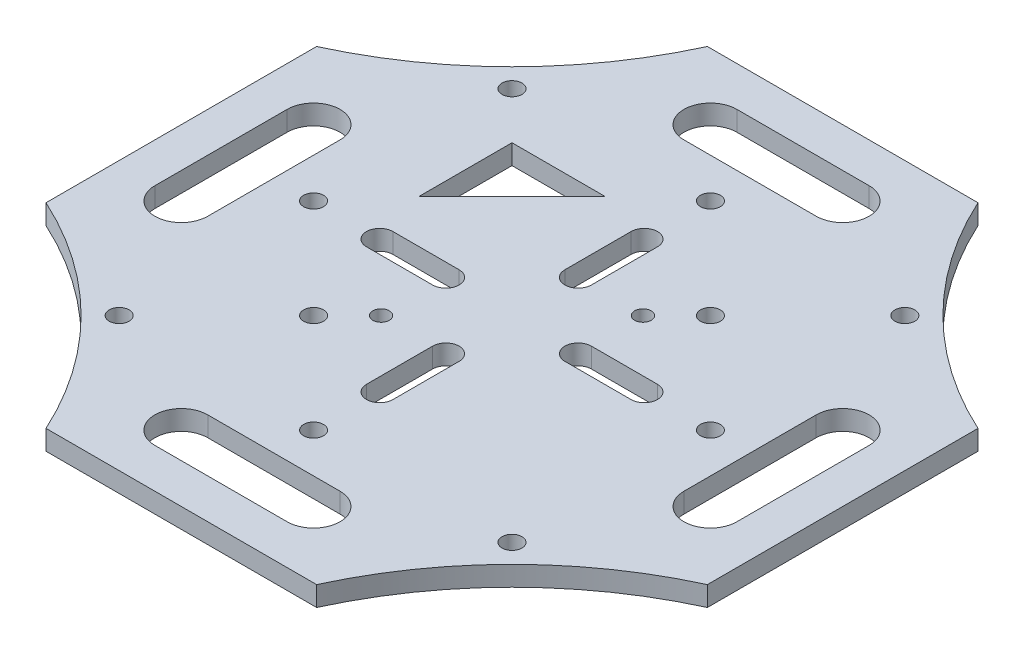
from build123d import *

# Parameters (mm, degrees)
SKETCH_1_R               = 1.25
EXTRUDE_1_DEPTH          = 3
SKETCH_2_R               = 1.5
CUT_EXTRUDE_1_DEPTH      = 3
CUT_EXTRUDE_2_DEPTH      = 3
CUT_EXTRUDE_3_DEPTH      = 3
CUT_EXTRUDE_4_DEPTH      = 10
SKETCH_6_R               = 1.5
CUT_EXTRUDE_5_DEPTH      = 10
SKETCH_7_R               = 1.5
CUT_EXTRUDE_8_DEPTH      = 10
SKETCH_8_R               = 1.5
CUT_EXTRUDE_9_DEPTH      = 10
SKETCH_9_R               = 15
CUT_EXTRUDE_10_DEPTH     = 10
SKETCH_11_R              = 1.5
EXTRUDE_3_DEPTH          = 3
CUT_EXTRUDE_12_DEPTH     = 3
EXTRUDE_4_DEPTH          = 3
SKETCH_15_R              = 15
EXTRUDE_5_DEPTH          = 3
CUT_EXTRUDE_13_DEPTH     = 3
EXTRUDE_START            = -3
EXTRUDE_7_DEPTH          = 3
CUT_EXTRUDE_14_DEPTH     = 3
CUT_EXTRUDE_15_DEPTH     = 3
PATTERN_CIRCULAR_1_COUNT = 8
SKETCH_22_R              = 1.25
CUT_EXTRUDE_17_DEPTH     = 3
SKETCH_23_R              = 1.5
CUT_EXTRUDE_18_DEPTH     = 10
SKETCH_24_R              = 1.5
CUT_EXTRUDE_19_DEPTH     = 10
CUT_EXTRUDE_START        = -48
CUT_EXTRUDE_21_DEPTH     = 48
SKETCH_26_W              = 47.062790234
SKETCH_26_H              = 40.912878854
SKETCH_26_W_2            = 40.912878854
SKETCH_26_H_2            = 47.062790234
CUT_EXTRUDE_22_DEPTH     = 48


with BuildPart() as part:
    # 草图1 → 凸台-拉伸1 (new body)
    # profile 1 of 4: a face of its own
    with BuildSketch(Plane(origin=(0, 0, 0), x_dir=(1, 0, 0), z_dir=(0, 1, 0))):
        with BuildLine():
            ThreePointArc((75, -15), (32.573593129, -32.573593129), (15, -75))
            Line((15, -75), (0, -75))
            Line((0, -75), (0, 0))
            Line((0, 0), (75, 0))
            Line((75, 0), (75, -15))
        make_face()
        with Locations(Location((11, -70, 0), (0, 0, 270))):
            Circle(SKETCH_1_R, mode=Mode.SUBTRACT)
        with Locations(Location((70, -11, 0), (0, 0, 270))):
            Circle(SKETCH_1_R, mode=Mode.SUBTRACT)
    # profile 2 of 4: a face of its own
    with BuildSketch(Plane(origin=(0, 0, 0), x_dir=(1, 0, 0), z_dir=(0, 1, 0))):
        with BuildLine():
            ThreePointArc((-15, -75), (-32.573593129, -32.573593129), (-75, -15))
            Line((-75, -15), (-75, 0))
            Line((-75, 0), (0, 0))
            Line((0, 0), (0, -75))
            Line((0, -75), (-15, -75))
        make_face()
        with Locations(Location((-70, -11, 0), (0, 0, 270))):
            Circle(SKETCH_1_R, mode=Mode.SUBTRACT)
        with Locations(Location((-11, -70, 0), (0, 0, 270))):
            Circle(SKETCH_1_R, mode=Mode.SUBTRACT)
    # profile 3 of 4: a face of its own
    with BuildSketch(Plane(origin=(0, 0, 0), x_dir=(1, 0, 0), z_dir=(0, 1, 0))):
        with BuildLine():
            ThreePointArc((-75, 15), (-32.573593129, 32.573593129), (-15, 75))
            Line((-15, 75), (0, 75))
            Line((0, 75), (0, 0))
            Line((0, 0), (-75, 0))
            Line((-75, 0), (-75, 15))
        make_face()
        with Locations(Location((-11, 70, 0), (0, 0, 270))):
            Circle(SKETCH_1_R, mode=Mode.SUBTRACT)
        with Locations(Location((-70, 11, 0), (0, 0, 270))):
            Circle(SKETCH_1_R, mode=Mode.SUBTRACT)
    # profile 4 of 4: a face of its own
    with BuildSketch(Plane(origin=(0, 0, 0), x_dir=(1, 0, 0), z_dir=(0, 1, 0))):
        with BuildLine():
            ThreePointArc((15, 75), (32.573593129, 32.573593129), (75, 15))
            Line((75, 15), (75, 0))
            Line((75, 0), (0, 0))
            Line((0, 0), (0, 75))
            Line((0, 75), (15, 75))
        make_face()
        with Locations(Location((70, 11, 0), (0, 0, 270))):
            Circle(SKETCH_1_R, mode=Mode.SUBTRACT)
        with Locations(Location((11, 70, 0), (0, 0, 270))):
            Circle(SKETCH_1_R, mode=Mode.SUBTRACT)
    extrude(amount=EXTRUDE_1_DEPTH)

    # 草图2 → 切除-拉伸1 (cut)
    with BuildSketch(Plane.XZ):
        with Locations(Location((0.353553391, -31.466251763, 0), (0, 0, 270))):
            Circle(SKETCH_2_R)
        with Locations(Location((31.466251763, -0.353553391, 0), (0, 0, 270))):
            Circle(SKETCH_2_R)
        with Locations(Location((-0.353553391, 31.466251763, 0), (0, 0, 90))):
            Circle(SKETCH_2_R)
        with Locations(Location((-31.466251763, 0.353553391, 0), (0, 0, 90))):
            Circle(SKETCH_2_R)
    extrude(amount=-CUT_EXTRUDE_1_DEPTH, mode=Mode.SUBTRACT)

    # 草图3 → 切除-拉伸2 (cut)
    with BuildSketch(Plane(origin=(0, 3, 0), x_dir=(1, 0, 0), z_dir=(0, 1, 0))):
        Polygon((-15.556349186, 15.556349186), (-12.02081528, 19.091883092), (-22.627416998, 22.627416998), align=None)
        Polygon((-19.091883092, 12.02081528), (-15.556349186, 15.556349186), (-22.627416998, 22.627416998), align=None)
    extrude(amount=-CUT_EXTRUDE_2_DEPTH, mode=Mode.SUBTRACT)

    # 草图4 → 切除-拉伸3 (cut)
    with BuildSketch(Plane(origin=(0, 3, 0), x_dir=(1, 0, 0), z_dir=(0, 1, 0))):
        with BuildLine():
            ThreePointArc((33.944668714, -19.80253309), (34.043922781, -8.582763971), (22.827665534, -8.285032838))
            Line((22.827665534, -8.285032838), (15.556349186, -15.556349186))
            Line((15.556349186, -15.556349186), (8.285032838, -22.827665534))
            ThreePointArc((8.285032838, -22.827665534), (8.582763971, -34.043922781), (19.80253309, -33.944668714))
            Line((19.80253309, -33.944668714), (33.944668714, -19.80253309))
        make_face()
    extrude(amount=-CUT_EXTRUDE_3_DEPTH, mode=Mode.SUBTRACT)

    # 草图5 → 切除-拉伸4 (cut)
    with BuildSketch(Plane(origin=(0, 3, 0), x_dir=(1, 0, 0), z_dir=(0, 1, 0))):
        Polygon((-22.627416998, 8.485281374), (-22.627416998, 22.627416998), (-19.091883092, 12.02081528), align=None)
        Polygon((-12.02081528, 19.091883092), (-22.627416998, 22.627416998), (-8.485281374, 22.627416998), align=None)
    extrude(amount=-CUT_EXTRUDE_4_DEPTH, mode=Mode.SUBTRACT)

    # 草图6 → 切除-拉伸5 (cut)
    with BuildSketch(Plane(origin=(0, 3, 0), x_dir=(1, 0, 0), z_dir=(0, 1, 0))):
        with Locations(Location((-35.355339059, -21.213203436, 0), (0, 0, 270))):
            Circle(SKETCH_6_R)
        with Locations(Location((-21.213203436, -35.355339059, 0), (0, 0, 270))):
            Circle(SKETCH_6_R)
        with Locations(Location((35.355339059, 21.213203436, 0), (0, 0, 270))):
            Circle(SKETCH_6_R)
        with Locations(Location((21.213203436, 35.355339059, 0), (0, 0, 270))):
            Circle(SKETCH_6_R)
    extrude(amount=-CUT_EXTRUDE_5_DEPTH, mode=Mode.SUBTRACT)

    # 草图7 → 切除-拉伸8 (cut)
    with BuildSketch(Plane(origin=(0, 3, 0), x_dir=(1, 0, 0), z_dir=(0, 1, 0))):
        with Locations(Location((-29.69848481, 29.69848481, 0), (0, 0, 270))):
            Circle(SKETCH_7_R)
        with Locations(Location((29.69848481, 29.69848481, 0), (0, 0, 270))):
            Circle(SKETCH_7_R)
        with Locations(Location((29.69848481, -29.69848481, 0), (0, 0, 270))):
            Circle(SKETCH_7_R)
        with Locations(Location((-29.69848481, -29.69848481, 0), (0, 0, 270))):
            Circle(SKETCH_7_R)
    extrude(amount=-CUT_EXTRUDE_8_DEPTH, mode=Mode.SUBTRACT)

    # 草图8 → 切除-拉伸9 (cut)
    with BuildSketch(Plane(origin=(0, 3, 0), x_dir=(1, 0, 0), z_dir=(0, 1, 0))):
        with Locations(Location((-11, 55, 0), (0, 0, 270))):
            Circle(SKETCH_8_R)
        with Locations(Location((11, 55, 0), (0, 0, 270))):
            Circle(SKETCH_8_R)
        with Locations(Location((55, 11, 0), (0, 0, 270))):
            Circle(SKETCH_8_R)
        with Locations(Location((55, -11, 0), (0, 0, 270))):
            Circle(SKETCH_8_R)
        with Locations(Location((11, -55, 0), (0, 0, 270))):
            Circle(SKETCH_8_R)
        with Locations(Location((-11, -55, 0), (0, 0, 270))):
            Circle(SKETCH_8_R)
        with Locations(Location((-55, -11, 0), (0, 0, 270))):
            Circle(SKETCH_8_R)
        with Locations(Location((-55, 11, 0), (0, 0, 270))):
            Circle(SKETCH_8_R)
    extrude(amount=-CUT_EXTRUDE_9_DEPTH, mode=Mode.SUBTRACT)

    # 草图9 → 切除-拉伸10 (cut)
    with BuildSketch(Plane(origin=(0, 3, 0), x_dir=(1, 0, 0), z_dir=(0, 1, 0))):
        with Locations(Location((0, 0, 0), (0, 0, 270))):
            Circle(SKETCH_9_R)
    extrude(amount=-CUT_EXTRUDE_10_DEPTH, mode=Mode.SUBTRACT)

    # 草图11 → 凸台-拉伸3 (add)
    with BuildSketch(Plane(origin=(0, 3, 0), x_dir=(1, 0, 0), z_dir=(0, 1, 0))):
        with Locations((-35.355339059, -21.213203436)):
            Circle(SKETCH_11_R)
        with Locations((35.355339059, 21.213203436)):
            Circle(SKETCH_11_R)
        with Locations((21.213203436, 35.355339059)):
            Circle(SKETCH_11_R)
        with Locations((0.353553391, 31.466251763)):
            Circle(SKETCH_11_R)
        with Locations((31.466251763, 0.353553391)):
            Circle(SKETCH_11_R)
        with Locations((-0.353553391, -31.466251763)):
            Circle(SKETCH_11_R)
        with Locations((-31.466251763, -0.353553391)):
            Circle(SKETCH_11_R)
        with Locations((-21.213203436, -35.355339059)):
            Circle(SKETCH_11_R)
    extrude(amount=-EXTRUDE_3_DEPTH)

    # 草图12 → 切除-拉伸12 (cut)
    with BuildSketch(Plane(origin=(0, 3, 0), x_dir=(1, 0, 0), z_dir=(0, 1, 0))):
        with BuildLine():
            Line((-44, -10), (-44, 10))
            ThreePointArc((-44, 10), (-40, 14), (-36, 10))
            Line((-36, 10), (-36, -10))
            ThreePointArc((-36, -10), (-40, -14), (-44, -10))
        make_face()
        with BuildLine():
            Line((-10, 44), (10, 44))
            ThreePointArc((10, 44), (14, 40), (10, 36))
            Line((10, 36), (-10, 36))
            ThreePointArc((-10, 36), (-14, 40), (-10, 44))
        make_face()
        with BuildLine():
            Line((44, 10), (44, -10))
            ThreePointArc((44, -10), (40, -14), (36, -10))
            Line((36, -10), (36, 10))
            ThreePointArc((36, 10), (40, 14), (44, 10))
        make_face()
        with BuildLine():
            Line((10, -44), (-10, -44))
            ThreePointArc((-10, -44), (-14, -40), (-10, -36))
            Line((-10, -36), (10, -36))
            ThreePointArc((10, -36), (14, -40), (10, -44))
        make_face()
    extrude(amount=-CUT_EXTRUDE_12_DEPTH, mode=Mode.SUBTRACT)

    # 草图14 → 凸台-拉伸4 (add)
    with BuildSketch(Plane(origin=(0, 3, 0), x_dir=(1, 0, 0), z_dir=(0, 1, 0))):
        with BuildLine():
            ThreePointArc((32.185650849, -7.152183109), (27.322232167, -6.195143755), (22.827665534, -8.285032838))
            Line((22.827665534, -8.285032838), (21.61516096, -18.569682002))
            ThreePointArc((21.61516096, -18.569682002), (27.487806659, -22.107425519), (33.944668714, -19.80253309))
            ThreePointArc((33.944668714, -19.80253309), (35.679936943, -17.205520658), (36.289282113, -14.142135624))
            ThreePointArc((36.289282113, -14.142135624), (35.187559777, -10.089382679), (32.185650849, -7.152183109))
        make_face()
        with BuildLine():
            Line((22.827665534, -8.285032838), (22.427168462, -8.685529911))
            ThreePointArc((22.427168462, -8.685529911), (20.306137435, -13.486712231), (21.61516096, -18.569682002))
            Line((21.61516096, -18.569682002), (22.827665534, -8.285032838))
        make_face()
        with BuildLine():
            Line((22.427168462, -8.685529911), (8.285032838, -22.827665534))
            ThreePointArc((8.285032838, -22.827665534), (8.582763971, -34.043922781), (19.80253309, -33.944668714))
            Line((19.80253309, -33.944668714), (21.61516096, -18.569682002))
            ThreePointArc((21.61516096, -18.569682002), (20.306137435, -13.486712231), (22.427168462, -8.685529911))
        make_face()
        with BuildLine():
            Line((21.61516096, -18.569682002), (19.80253309, -33.944668714))
            Line((19.80253309, -33.944668714), (33.944668714, -19.80253309))
            ThreePointArc((33.944668714, -19.80253309), (27.487806659, -22.107425519), (21.61516096, -18.569682002))
        make_face()
    extrude(amount=-EXTRUDE_4_DEPTH)

    # 草图15 → 凸台-拉伸5 (add)
    with BuildSketch(Plane(origin=(0, 3, 0), x_dir=(1, 0, 0), z_dir=(0, 1, 0))):
        Circle(SKETCH_15_R)
    extrude(amount=-EXTRUDE_5_DEPTH)

    # 草图17 → 切除-拉伸13 (cut)
    with BuildSketch(Plane(origin=(0, 3, 0), x_dir=(1, 0, 0), z_dir=(0, 1, 0))):
        with BuildLine():
            Line((-2, -20), (-2, -10))
            ThreePointArc((-2, -10), (0, -8), (2, -10))
            Line((2, -10), (2, -20))
            ThreePointArc((2, -20), (0, -22), (-2, -20))
        make_face()
        with BuildLine():
            Line((-20, 2), (-10, 2))
            ThreePointArc((-10, 2), (-8, 0), (-10, -2))
            Line((-10, -2), (-20, -2))
            ThreePointArc((-20, -2), (-22, 0), (-20, 2))
        make_face()
        with BuildLine():
            Line((2, 20), (2, 10))
            ThreePointArc((2, 10), (0, 8), (-2, 10))
            Line((-2, 10), (-2, 20))
            ThreePointArc((-2, 20), (0, 22), (2, 20))
        make_face()
        with BuildLine():
            Line((20, -2), (10, -2))
            ThreePointArc((10, -2), (8, 0), (10, 2))
            Line((10, 2), (20, 2))
            ThreePointArc((20, 2), (22, 0), (20, -2))
        make_face()
    extrude(amount=-CUT_EXTRUDE_13_DEPTH, mode=Mode.SUBTRACT)

    # 草图18 → 凸台-拉伸7 (add)
    with BuildSketch(Plane(origin=(0, 3, 0), x_dir=(1, 0, 0), z_dir=(0, 1, 0)).offset(EXTRUDE_START)):
        with BuildLine():
            Line((-61.977302058, 38.525223259), (-50.251262658, 50.251262658))
            Line((-50.251262658, 50.251262658), (-38.525223259, 61.977302058))
            ThreePointArc((-38.525223259, 61.977302058), (-38.078377186, 64.938218885), (-37.928932188, 67.928932188))
            ThreePointArc((-37.928932188, 67.928932188), (-91.15121571, 86.921708395), (-61.977302058, 38.525223259))
        make_face()
        with BuildLine():
            ThreePointArc((-61.977302058, 38.525223259), (-53.742560533, 41.49511182), (-46.715728753, 46.715728753))
            Line((-46.715728753, 46.715728753), (-50.251262658, 50.251262658))
            Line((-50.251262658, 50.251262658), (-61.977302058, 38.525223259))
        make_face()
        with BuildLine():
            Line((-50.251262658, 50.251262658), (-46.715728753, 46.715728753))
            ThreePointArc((-46.715728753, 46.715728753), (-41.49511182, 53.742560534), (-38.525223259, 61.977302058))
            Line((-38.525223259, 61.977302058), (-50.251262658, 50.251262658))
        make_face()
        with BuildLine():
            ThreePointArc((-45.952273324, 22.500194525), (-38.909748111, 27.067821679), (-32.573593129, 32.573593129))
            Line((-32.573593129, 32.573593129), (-46.715728753, 46.715728753))
            ThreePointArc((-46.715728753, 46.715728753), (-53.742560533, 41.49511182), (-61.977302058, 38.525223259))
            Line((-61.977302058, 38.525223259), (-45.952273324, 22.500194525))
        make_face()
        with BuildLine():
            Line((-46.715728753, 46.715728753), (-32.573593129, 32.573593129))
            ThreePointArc((-32.573593129, 32.573593129), (-27.067821679, 38.909748111), (-22.500194525, 45.952273324))
            Line((-22.500194525, 45.952273324), (-38.525223259, 61.977302058))
            ThreePointArc((-38.525223259, 61.977302058), (-41.49511182, 53.742560534), (-46.715728753, 46.715728753))
        make_face()
    extrude(amount=EXTRUDE_7_DEPTH)

    # 草图19 → 切除-拉伸14 (cut)
    with BuildSketch(Plane(origin=(0, 3, 0), x_dir=(1, 0, 0), z_dir=(0, 1, 0))):
        with BuildLine():
            ThreePointArc((-37.140781925, 51.282917549), (-39.866501787, 47.012431525), (-43.180194847, 43.180194847))
            Line((-43.180194847, 43.180194847), (-36.109127035, 36.109127035))
            ThreePointArc((-36.109127035, 36.109127035), (-32.750813989, 39.866501787), (-29.833680261, 43.975815885))
            Line((-29.833680261, 43.975815885), (-37.140781925, 51.282917549))
        make_face()
        with BuildLine():
            Line((-36.109127035, 36.109127035), (-43.180194847, 43.180194847))
            ThreePointArc((-43.180194847, 43.180194847), (-47.012431525, 39.866501787), (-51.282917549, 37.140781925))
            Line((-51.282917549, 37.140781925), (-43.975815885, 29.833680261))
            ThreePointArc((-43.975815885, 29.833680261), (-39.866501787, 32.750813989), (-36.109127035, 36.109127035))
        make_face()
    extrude(amount=-CUT_EXTRUDE_14_DEPTH, mode=Mode.SUBTRACT)

    # 草图21 → 切除-拉伸15 (cut)
    with BuildSketch(Plane(origin=(0, 3, 0), x_dir=(1, 0, 0), z_dir=(0, 1, 0))):
        with BuildLine():
            Line((-81.187184335, 82.954951288), (-74.116116524, 75.883883476))
            ThreePointArc((-74.116116524, 75.883883476), (-74.116116524, 74.116116524), (-75.883883476, 74.116116524))
            Line((-75.883883476, 74.116116524), (-82.954951288, 81.187184335))
            ThreePointArc((-82.954951288, 81.187184335), (-82.954951288, 82.954951288), (-81.187184335, 82.954951288))
        make_face()
        with BuildLine():
            Line((-59.9739809, 61.741747853), (-52.902913088, 54.670680041))
            ThreePointArc((-52.902913088, 54.670680041), (-52.902913088, 52.902913088), (-54.670680041, 52.902913088))
            Line((-54.670680041, 52.902913088), (-61.741747853, 59.9739809))
            ThreePointArc((-61.741747853, 59.9739809), (-61.741747853, 61.741747853), (-59.9739809, 61.741747853))
        make_face()
    cut_extrude_15 = extrude(amount=-CUT_EXTRUDE_15_DEPTH, mode=Mode.SUBTRACT)

    # 阵列(圆周)1: 切除-拉伸15 ×8 about axis
    pattern_circular_1_axis = Axis((-67.928932188, 0, -67.928932188), (0, 1, 0))
    for i in range(1, PATTERN_CIRCULAR_1_COUNT):
        add(cut_extrude_15.rotate(pattern_circular_1_axis, i * 360 / PATTERN_CIRCULAR_1_COUNT), mode=Mode.SUBTRACT)

    # 草图22 → 切除-拉伸17 (cut)
    with BuildSketch(Plane(origin=(0, 3, 0), x_dir=(1, 0, 0), z_dir=(0, 1, 0))):
        with Locations(Location((9.899494937, 9.899494937, 0), (0, 0, 270))):
            Circle(SKETCH_22_R)
        with Locations(Location((-9.899494937, -9.899494937, 0), (0, 0, 270))):
            Circle(SKETCH_22_R)
    extrude(amount=-CUT_EXTRUDE_17_DEPTH, mode=Mode.SUBTRACT)

    # 草图23 → 切除-拉伸18 (cut)
    with BuildSketch(Plane(origin=(0, 3, 0), x_dir=(1, 0, 0), z_dir=(0, 1, 0))):
        with Locations(Location((0, 30, 0), (0, 0, 270))):
            Circle(SKETCH_23_R)
        with Locations(Location((30, 0, 0), (0, 0, 270))):
            Circle(SKETCH_23_R)
        with Locations(Location((0, -30, 0), (0, 0, 270))):
            Circle(SKETCH_23_R)
        with Locations(Location((-30, 0, 0), (0, 0, 270))):
            Circle(SKETCH_23_R)
    extrude(amount=-CUT_EXTRUDE_18_DEPTH, mode=Mode.SUBTRACT)

    # 草图24 → 切除-拉伸19 (cut)
    with BuildSketch(Plane(origin=(0, 3, 0), x_dir=(1, 0, 0), z_dir=(0, 1, 0))):
        with Locations(Location((-15, -15, 0), (0, 0, 270))):
            Circle(SKETCH_24_R)
        with Locations(Location((15, 15, 0), (0, 0, 270))):
            Circle(SKETCH_24_R)
    extrude(amount=-CUT_EXTRUDE_19_DEPTH, mode=Mode.SUBTRACT)

    # 草图25 → 切除-拉伸21 (cut)
    with BuildSketch(Plane(origin=(0, 3, 0), x_dir=(1, 0, 0), z_dir=(0, 1, 0)).offset(CUT_EXTRUDE_START)):
        with BuildLine():
            ThreePointArc((-22.500194525, 45.952273324), (-16.905300033, 59.999805477), (-15, 75))
            ThreePointArc((-15, 75), (-133.094699967, 90.000194523), (-22.500194525, 45.952273324))
        make_face()
    extrude(amount=CUT_EXTRUDE_21_DEPTH, mode=Mode.SUBTRACT)

    # 草图26 → 切除-拉伸22 (cut)
    with BuildSketch(Plane(origin=(0, 3, 0), x_dir=(1, 0, 0), z_dir=(0, 1, 0))):
        with Locations((73.531395117, 0)):
            Rectangle(SKETCH_26_W, SKETCH_26_H)
        with Locations((0, 73.531395117)):
            Rectangle(SKETCH_26_W_2, SKETCH_26_H_2)
        with Locations((-73.531395117, 0)):
            Rectangle(SKETCH_26_W, SKETCH_26_H)
        with Locations((0, -73.531395117)):
            Rectangle(SKETCH_26_W_2, SKETCH_26_H_2)
    extrude(amount=-CUT_EXTRUDE_22_DEPTH, mode=Mode.SUBTRACT)


solid = part.part
